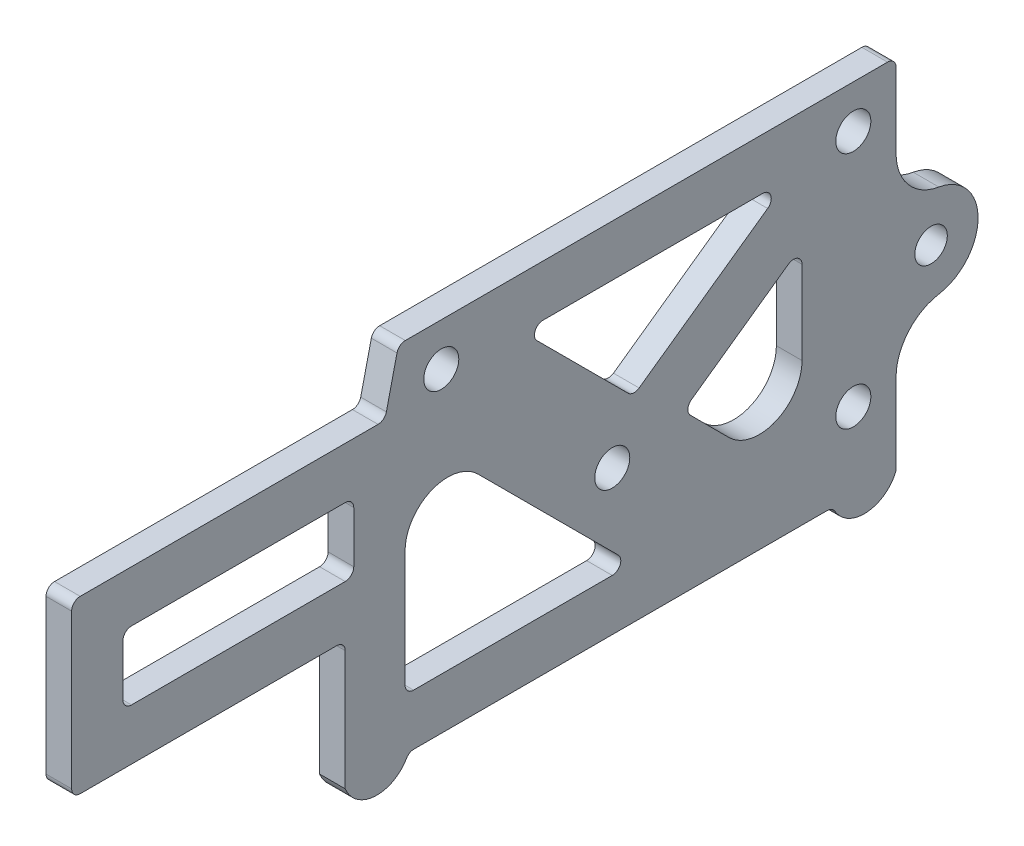
from build123d import *

# Parameters (mm, degrees)
SKETCH_1_R          = 2.05
SKETCH_1_R_2        = 1.9
EXTRUDE_1_DEPTH     = 3
SKETCH_2_W          = 27
SKETCH_2_H          = 8
CUT_EXTRUDE_1_DEPTH = 3
FILLET_1_R          = 5
FILLET_2_R          = 1
FILLET_3_R          = 6


with BuildPart() as part:
    # 草图1 → 凸台-拉伸1 (new body)
    with BuildSketch(Plane(origin=(0, 0, 0), x_dir=(0, 0, -1), z_dir=(1, 0, 0))):
        with BuildLine():
            Line((29.1, -22.95), (29.1, -7.630182627))
            Line((29.1, -7.630182627), (33.194571076, -7.630182627))
            ThreePointArc((33.194571076, -7.630182627), (38.694571076, -2.130182627), (33.194571076, 3.369817373))
            Line((33.194571076, 3.369817373), (29.1, 3.369817373))
            Line((29.1, 3.369817373), (29.1, 18.95))
            Line((29.1, 18.95), (-29.1, 18.95))
            Line((-29.1, 18.95), (-30.699580381, 12.05))
            Line((-30.699580381, 12.05), (-67.336045252, 12.05))
            Line((-67.336045252, 12.05), (-67.336045252, -7.95))
            Line((-67.336045252, -7.95), (-35.336045252, -7.95))
            Line((-35.336045252, -7.95), (-35.336045252, -22.95))
            ThreePointArc((-35.336045252, -22.95), (-31.627946009, -25.45), (-27.919846765, -22.95))
            Line((-27.919846765, -22.95), (21.683801513, -22.95))
            ThreePointArc((21.683801513, -22.95), (25.391900756, -25.45), (29.1, -22.95))
        make_face()
        with Locations((-24.1, 13.95)):
            Circle(SKETCH_1_R, mode=Mode.SUBTRACT)
        with Locations((24.1, 13.95)):
            Circle(SKETCH_1_R, mode=Mode.SUBTRACT)
        with Locations((24.1, -13.95)):
            Circle(SKETCH_1_R, mode=Mode.SUBTRACT)
        with Locations((-4.1, -6.05)):
            Circle(SKETCH_1_R, mode=Mode.SUBTRACT)
        with Locations((33.194571076, -2.130182627)):
            Circle(SKETCH_1_R_2, mode=Mode.SUBTRACT)
    extrude(amount=EXTRUDE_1_DEPTH)

    # 草图2 → 切除-拉伸1 (cut)
    with BuildSketch(Plane(origin=(3, 0, 0), x_dir=(0, 0, -1), z_dir=(1, 0, 0))):
        Polygon((-28.336045252, 9.700763878), (-28.336045252, -16.95), (-1.685281374, -16.95), align=None)
        with Locations((-47.836045252, 2.05)):
            Rectangle(SKETCH_2_W, SKETCH_2_H)
        Polygon((18.1, 5.403799603), (4.202253287, -4.45275835), (18.1, -18.350505063), align=None)
        Polygon((-14.614718626, 12.95), (16.63985744, 12.95), (-1.646014864, -0.018703762), align=None)
    extrude(amount=-CUT_EXTRUDE_1_DEPTH, mode=Mode.SUBTRACT)

    # 圆角1
    fillet_1_edges = [part.edges().sort_by_distance(p)[0] for p in [
        (1.5, -18.350505063, -18.1),
        (1.5, 9.700763878, 28.336045252),
    ]]
    fillet(fillet_1_edges, radius=FILLET_1_R)

    # 圆角2
    fillet_2_edges = [part.edges().sort_by_distance(p)[0] for p in [
        (1.5, 18.95, 29.1),
        (1.5, 18.95, -29.1),
        (1.5, -22.95, -21.683801513),
        (1.5, -22.95, 27.919846765),
        (1.5, -7.95, 35.336045252),
        (1.5, -7.95, 67.336045252),
        (1.5, 12.05, 67.336045252),
        (1.5, 12.05, 30.699580381),
        (1.5, -1.95, 61.336045252),
        (1.5, 6.05, 61.336045252),
        (1.5, 6.05, 34.336045252),
        (1.5, -1.95, 34.336045252),
        (1.5, -0.018703762, 1.646014864),
        (1.5, 12.95, 14.614718626),
        (1.5, 12.95, -16.63985744),
        (1.5, 5.403799603, -18.1),
        (1.5, -4.45275835, -4.202253287),
        (1.5, -16.95, 1.685281374),
        (1.5, -16.95, 28.336045252),
    ]]
    fillet(fillet_2_edges, radius=FILLET_2_R)

    # 圆角3
    fillet_3_edges = [part.edges().sort_by_distance(p)[0] for p in [
        (1.5, -7.630182627, -29.1),
        (1.5, 3.369817373, -29.1),
    ]]
    fillet(fillet_3_edges, radius=FILLET_3_R)


solid = part.part
